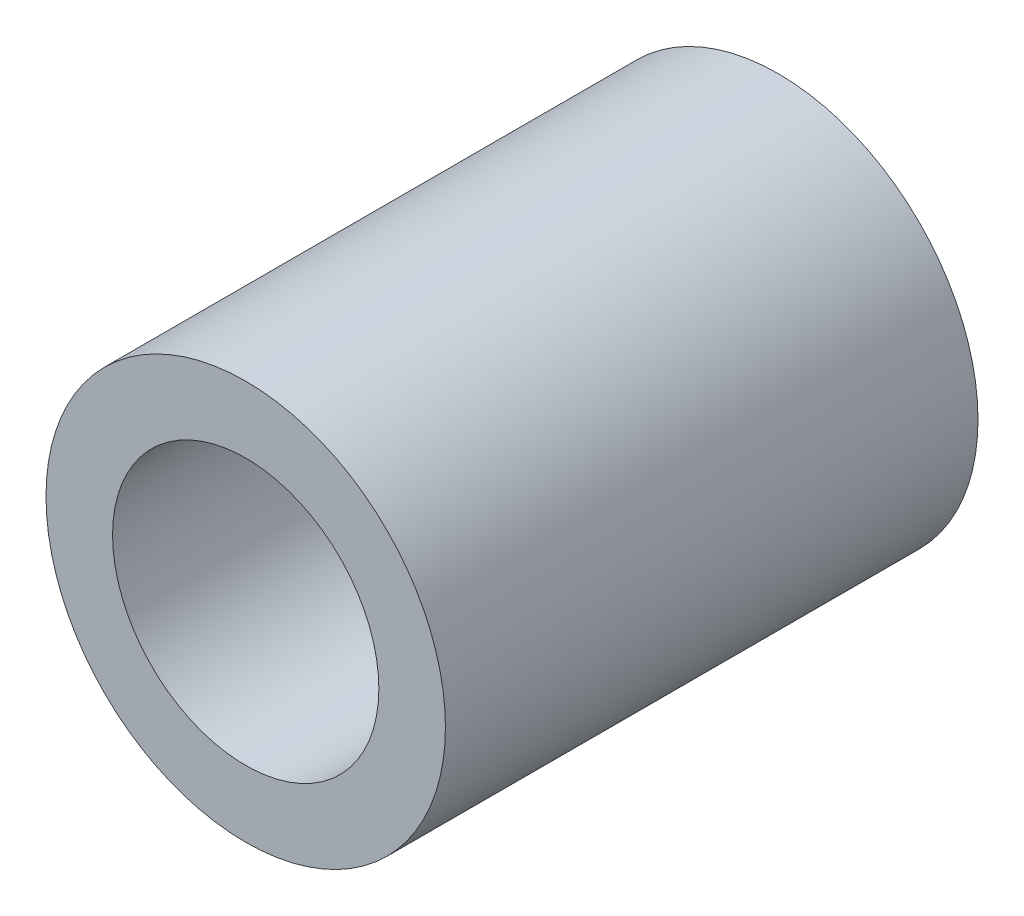
from build123d import *

# Parameters (mm, degrees)
SKETCH1_R      = 4.7625
SKETCH1_R_2    = 3.175
EXTRUDE1_DEPTH = 6.35


with BuildPart() as part:
    # Sketch1 → Extrude1 (new, symmetric)
    with BuildSketch(Plane.XY):
        Circle(SKETCH1_R)
        Circle(SKETCH1_R_2, mode=Mode.SUBTRACT)
    extrude(amount=EXTRUDE1_DEPTH, both=True)


solid = part.part
